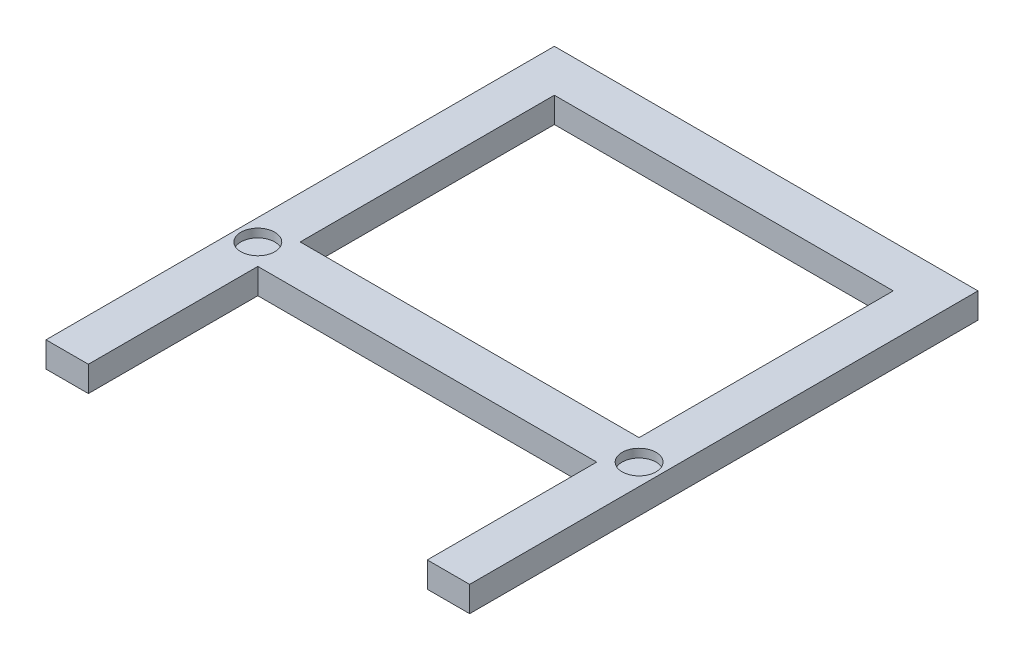
from build123d import *

# Parameters (mm, degrees)
SKETCH1_W           = 80
SKETCH1_H           = 60
BOSS_EXTRUDE1_DEPTH = 3
SKETCH2_R           = 4
CUT_EXTRUDE1_DEPTH  = 2


with BuildPart() as part:
    # Sketch1 → Boss-Extrude1 (new, symmetric)
    with BuildSketch(Plane(origin=(0, 0, 0), x_dir=(1, 0, 0), z_dir=(0, 1, 0))):
        Polygon((-50, 0), (50, 0), (50, -120), (40, -120), (40, -80), (-40, -80), (-40, -120), (-50, -120), align=None)
        with Locations((0, -40)):
            Rectangle(SKETCH1_W, SKETCH1_H, mode=Mode.SUBTRACT)
    extrude(amount=BOSS_EXTRUDE1_DEPTH, both=True)

    # Sketch2 → Cut-Extrude1 (cut)
    with BuildSketch(Plane(origin=(0, 3, 0), x_dir=(1, 0, 0), z_dir=(0, 1, 0))):
        with Locations(Location((-45, -75, 0), (0, 0, 270))):
            Circle(SKETCH2_R)
        with Locations(Location((45, -75, 0), (0, 0, 270))):
            Circle(SKETCH2_R)
    extrude(amount=-CUT_EXTRUDE1_DEPTH, mode=Mode.SUBTRACT)


solid = part.part
